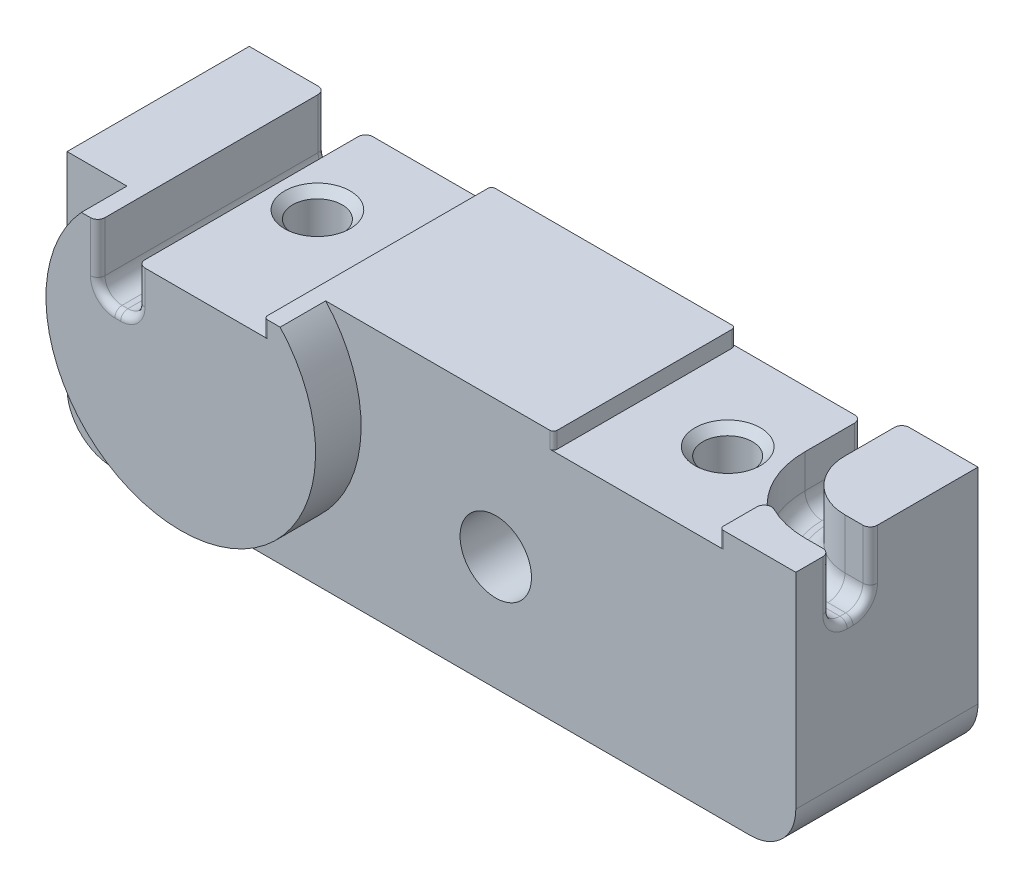
from build123d import *

# Parameters (mm, degrees)
SKETCH1_W                       = 50.8
SKETCH1_H                       = 17.4752
BOSS_EXTRUDE1_DEPTH             = 12.7
BOSS_EXTRUDE2_DEPTH             = 3.175
SKETCH12_W                      = 11.5824
SKETCH12_H                      = 31.04642485
SKETCH12_H_2                    = 37.220312072
CUT_EXTRUDE5_DEPTH              = 1.143
F_9_0_196_DIAMETER_HOLE1_D      = 4.9784
FILLET1_R                       = 3.175
F_8_32_TAPPED_HOLE2_D           = 3.4544
F_8_32_TAPPED_HOLE2_CSINK_D     = 4.572
F_8_32_TAPPED_HOLE2_CSINK_ANGLE = 90
SKETCH11_W                      = 2.794
SKETCH11_H                      = 23.198016048
CUT_EXTRUDE4_DEPTH              = 4.699
FILLET2_R                       = 1.1938
FILLET3_R                       = 0.508
FILLET4_R                       = 0.254
SKETCH16_R                      = 4.1656
CUT_EXTRUDE6_DEPTH              = 6.35
CHAMFER1_SIZE                   = 0.254
FILLET8_R                       = 0.508


with BuildPart() as part:
    # Sketch1 → Boss-Extrude1 (new body)
    with BuildSketch(Plane.XY):
        with Locations((0, -8.7376)):
            Rectangle(SKETCH1_W, SKETCH1_H)
    extrude(amount=-BOSS_EXTRUDE1_DEPTH)

    # Sketch2 → Boss-Extrude2 (add)
    with BuildSketch(Plane.XY):
        with BuildLine():
            Line((-21.228396302, 0), (-7.372003698, 0))
            ThreePointArc((-7.372003698, 0), (-14.3002, -15.748), (-21.228396302, 0))
        make_face()
    extrude(amount=BOSS_EXTRUDE2_DEPTH)

    # Sketch12 → Cut-Extrude5 (cut)
    with BuildSketch(Plane(origin=(0, 0, 0), x_dir=(1, 0, 0), z_dir=(0, 1, 0))):
        with Locations((14.3002, 4.674371042)):
            Rectangle(SKETCH12_W, SKETCH12_H)
        with Locations((-14.3002, 2.29159367)):
            Rectangle(SKETCH12_W, SKETCH12_H_2)
    extrude(amount=-CUT_EXTRUDE5_DEPTH, mode=Mode.SUBTRACT)

    # #9 (0.196) Diameter Hole1 (through all)
    with Locations(Plane(origin=(33.7312, -2.208443868, 0), x_dir=(1, 0, 0), z_dir=(0, 0, 1))):
        with Locations((-29.247846689, -7.316556132)):
            Hole(F_9_0_196_DIAMETER_HOLE1_D / 2)

    # Fillet1
    fillet1_edges = [part.edges().sort_by_distance(p)[0] for p in [
        (25.4, -17.4752, -6.35),
        (-25.4, -17.4752, -6.35),
    ]]
    fillet(fillet1_edges, radius=FILLET1_R)

    # #8-32 Tapped Hole2 (through all)
    with Locations(Plane(origin=(26.700019519, -1.143, -0.758269739), x_dir=(-1, 0, 0), z_dir=(0, 1, 0))):
        with Locations((12.399819519, -5.591730261), (41.000219519, -5.591730261)):
            CounterSinkHole(F_8_32_TAPPED_HOLE2_D / 2, F_8_32_TAPPED_HOLE2_CSINK_D / 2, counter_sink_angle=F_8_32_TAPPED_HOLE2_CSINK_ANGLE)

    # Sketch11 → Cut-Extrude4 (cut)
    with BuildSketch(Plane(origin=(0, 0, 0), x_dir=(1, 0, 0), z_dir=(0, 1, 0))):
        with BuildLine():
            Line((20.0914, 20.298121943), (20.0914, 8.7376))
            ThreePointArc((20.0914, 8.7376), (21.132928286, 6.223128286), (23.6474, 5.1816))
            Line((23.6474, 5.1816), (32.110940615, 5.1816))
            Line((32.110940615, 5.1816), (32.110940615, 2.3876))
            Line((32.110940615, 2.3876), (23.6474, 2.3876))
            ThreePointArc((23.6474, 2.3876), (19.157271939, 4.247471939), (17.2974, 8.7376))
            Line((17.2974, 8.7376), (17.2974, 20.298121943))
            Line((17.2974, 20.298121943), (20.0914, 20.298121943))
        make_face()
        with Locations((-18.6944, 5.241099364)):
            Rectangle(SKETCH11_W, SKETCH11_H)
    extrude(amount=-CUT_EXTRUDE4_DEPTH, mode=Mode.SUBTRACT)

    # Fillet2
    fillet2_edges = [part.edges().sort_by_distance(p)[0] for p in [
        (24.5237, -4.699, -5.1816),
        (24.5237, -4.699, -2.3876),
        (19.157271939, -4.699, -4.247471939),
        (17.2974, -4.699, -10.7188),
        (20.0914, -4.699, -10.7188),
        (21.132928286, -4.699, -6.223128286),
        (-17.2974, -4.699, -4.7625),
        (-20.0914, -4.699, -4.7625),
    ]]
    fillet(fillet2_edges, radius=FILLET2_R)

    # Fillet3
    fillet3_edges = [part.edges().sort_by_distance(p)[0] for p in [
        (20.0914, -0.5715, -3.476671945),
    ]]
    fillet(fillet3_edges, radius=FILLET3_R)

    # Fillet4
    fillet4_edges = [part.edges().sort_by_distance(p)[0] for p in [
        (-8.509, -0.5715, 3.175),
        (-8.509, -0.5715, -12.7),
        (8.509, -0.5715, -12.7),
        (8.509, -0.5715, 0),
        (20.0914, -0.5715, 0),
    ]]
    fillet(fillet4_edges, radius=FILLET4_R)

    # Sketch16 → Cut-Extrude6 (cut)
    with BuildSketch(Plane(origin=(0, 0, -12.7), x_dir=(-1, 0, 0), z_dir=(0, 0, -1))):
        with Locations((-4.483353311, -9.525)):
            Circle(SKETCH16_R)
    extrude(amount=-CUT_EXTRUDE6_DEPTH, mode=Mode.SUBTRACT)

    # Chamfer1
    chamfer1_edges = [part.edges().sort_by_distance(p)[0] for p in [
        (8.648953311, -9.525, -12.7),
        (6.972553311, -9.525, -6.35),
    ]]
    chamfer(chamfer1_edges, length=CHAMFER1_SIZE)

    # Fillet8
    fillet8_edges = [part.edges().sort_by_distance(p)[0] for p in [
        (25.4, -1.7526, -2.3876),
        (17.2974, -2.3241, -12.7),
        (18.6944, -4.699, -12.7),
        (25.4, -4.699, -3.7846),
        (25.4, -1.7526, -5.1816),
        (-18.6944, -4.699, -12.7),
        (-18.6944, -4.699, 3.175),
        (-17.2974, -2.3241, 3.175),
        (-17.2974, -2.3241, -12.7),
        (20.0914, -1.7526, -12.7),
        (25.4, -4.349344075, -2.737255925),
        (25.4, -4.349344075, -4.831944075),
        (-19.741744075, -4.349344075, -12.7),
        (-19.741744075, -4.349344075, 3.175),
        (-17.647055925, -4.349344075, 3.175),
        (-17.647055925, -4.349344075, -12.7),
        (17.647055925, -4.349344075, -12.7),
        (19.741744075, -4.349344075, -12.7),
        (-20.0914, -1.7526, 3.175),
        (-20.0914, -1.7526, -12.7),
    ]]
    fillet(fillet8_edges, radius=FILLET8_R)


solid = part.part
